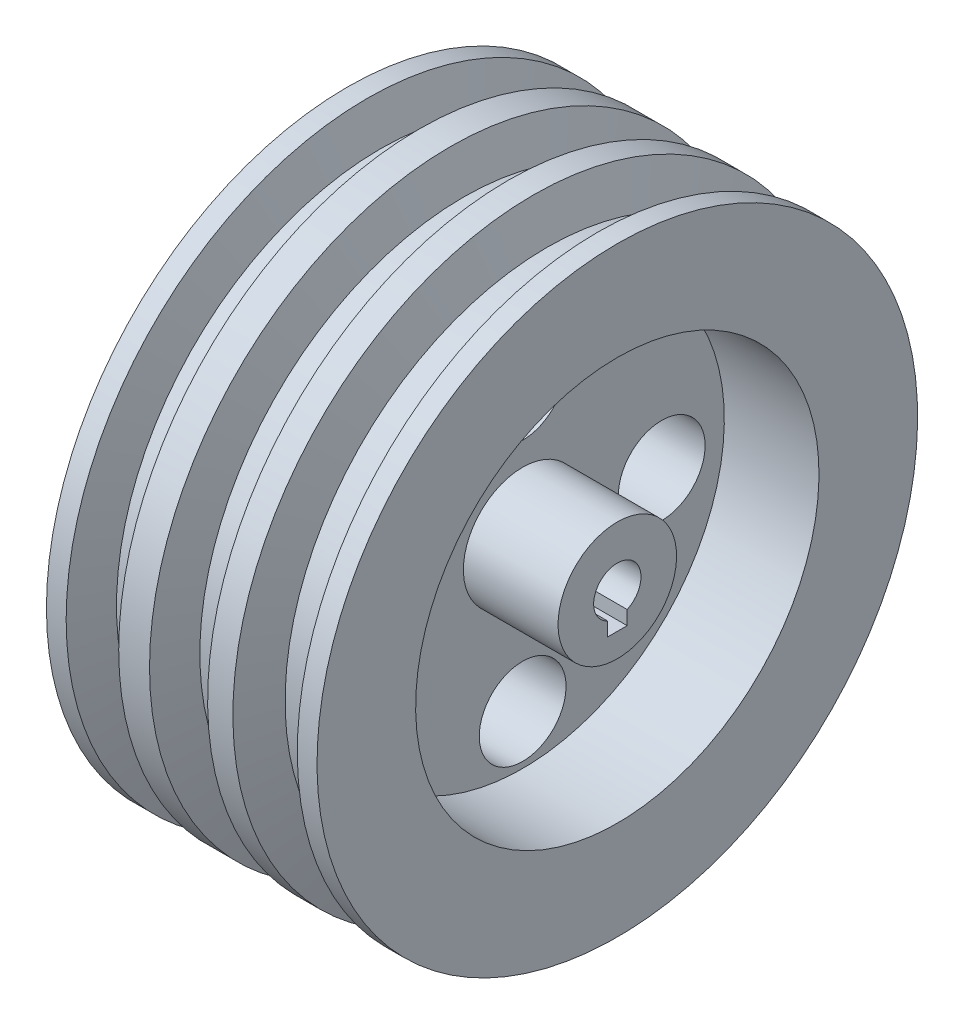
from build123d import *

# Parameters (mm, degrees)
SKETCH2_R          = 11
CUT_EXTRUDE1_DEPTH = 120.475538825
SKETCH3_W          = 5
SKETCH3_H          = 6
CUT_EXTRUDE2_DEPTH = 131.607826632


with BuildPart() as part:
    # Sketch1 → Revolve3 (revolve)
    with BuildSketch(Plane.XY):
        Polygon((35, 79.435897436), (35, 54.435897436), (11, 54.435897436), (11, 18.333333333), (35, 18.333333333), (35, 9.307692308), (-35, 9.307692308), (-35, 18.333333333), (-11, 18.333333333), (-11, 54.605542618), (-33.423992019, 54.605542618), (-33.423992019, 79.605542618), (-28.423992019, 79.605542618), (-25.019939293, 70.252984619), (-18.554189686, 70.252984619), (-15.177301066, 79.530909851), (-7.364883216, 79.530909851), (-3.96083049, 70.178351852), (3.910516857, 70.178351852), (7.287405478, 79.456277085), (13.694225587, 79.456277085), (17.226586544, 69.751195119), (26.475056629, 69.751195119), (30, 79.435897436), align=None)
    revolve(axis=Axis((74.179487179, 3.307692308, 0), (-1, 0, 0)))

    # Sketch2 → Cut-Extrude1 (cut, through all)
    with BuildSketch(Plane(origin=(11, 0, 0), x_dir=(0, 0, -1), z_dir=(1, 0, 0))):
        with Locations(Location((0, 35.256915145, 0), (0, 0, 90))):
            Circle(SKETCH2_R)
        with Locations(Location((35.256915145, 0, 0), (0, 0, 90))):
            Circle(SKETCH2_R)
        with Locations(Location((0, -35.256915145, 0), (0, 0, 90))):
            Circle(SKETCH2_R)
        with Locations(Location((-35.256915145, 0, 0), (0, 0, 90))):
            Circle(SKETCH2_R)
    extrude(amount=-CUT_EXTRUDE1_DEPTH, mode=Mode.SUBTRACT)

    # Sketch3 → Cut-Extrude2 (cut, through all)
    with BuildSketch(Plane.ZY.offset(35)):
        with Locations((0, -2.692307692)):
            Rectangle(SKETCH3_W, SKETCH3_H)
    extrude(amount=-CUT_EXTRUDE2_DEPTH, mode=Mode.SUBTRACT)


solid = part.part
